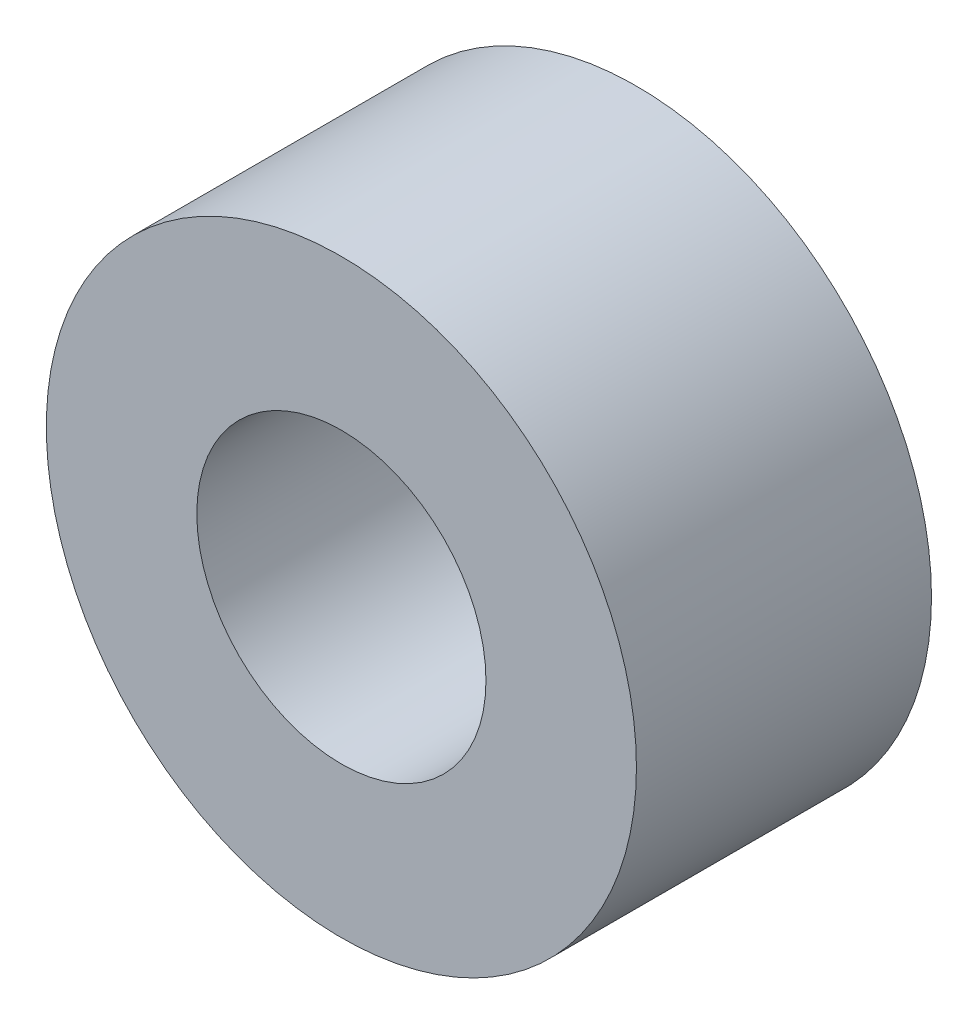
from build123d import *

# Parameters (mm, degrees)
SKETCH_1_R      = 5
SKETCH_1_R_2    = 2.45
EXTRUDE_1_DEPTH = 5


with BuildPart() as part:
    # 草图1 → 凸台-拉伸1 (new body)
    with BuildSketch(Plane.XY):
        Circle(SKETCH_1_R)
        Circle(SKETCH_1_R_2, mode=Mode.SUBTRACT)
    extrude(amount=EXTRUDE_1_DEPTH)


solid = part.part
